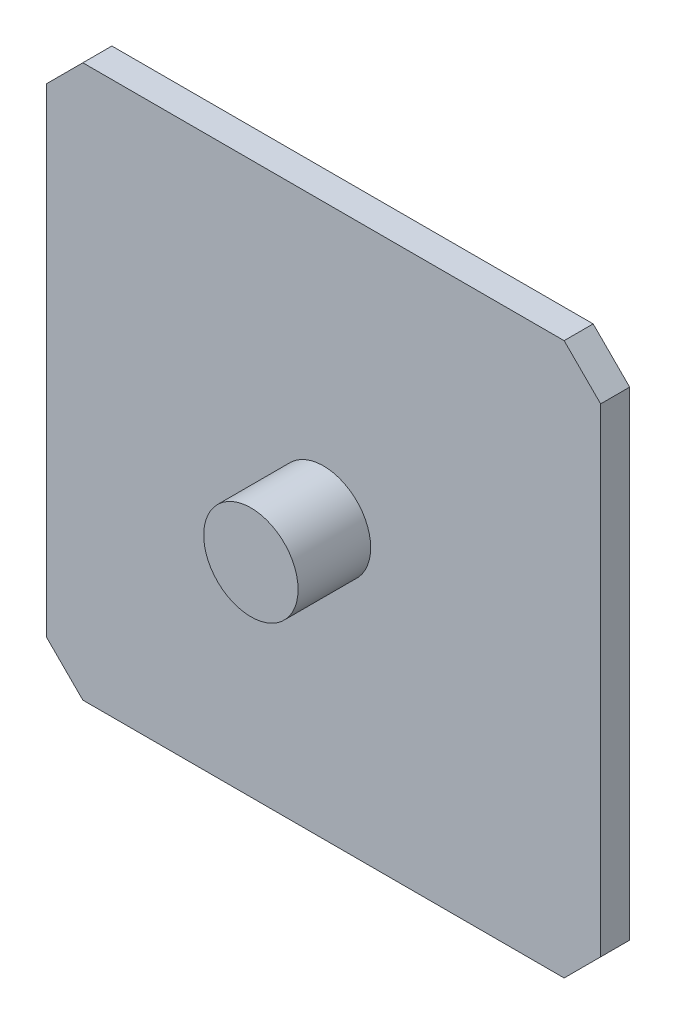
from build123d import *

# Parameters (mm, degrees)
BOSS_EXTRUDE1_DEPTH = 2
SKETCH3_R           = 3.2512
BOSS_EXTRUDE2_DEPTH = 5


with BuildPart() as part:
    # Sketch2 → Boss-Extrude1 (new body)
    with BuildSketch(Plane.XY):
        Polygon((16.575197596, -19.009332943), (-16.575197596, -19.009332943), (-19.089797596, -16.494732943), (-19.089797596, 16.494732943), (-16.575197596, 19.009332943), (16.575197596, 19.009332943), (19.089797596, 16.494732943), (19.089797596, -16.494732943), align=None)
    extrude(amount=BOSS_EXTRUDE1_DEPTH)

    # Sketch3 → Boss-Extrude2 (add)
    with BuildSketch(Plane.XY.offset(2)):
        Circle(SKETCH3_R)
    extrude(amount=BOSS_EXTRUDE2_DEPTH)


solid = part.part
